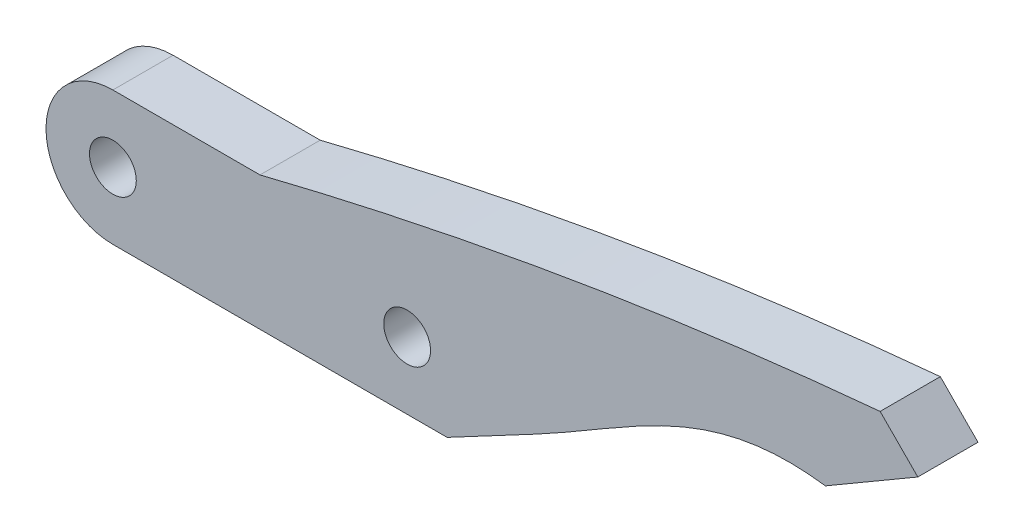
from build123d import *

# Parameters (mm, degrees)
SKETCH1_R           = 5
SKETCH1_R_2         = 1.75
BOSS_EXTRUDE1_DEPTH = 4.5
BOSS_EXTRUDE2_START = -4.5
BOSS_EXTRUDE2_DEPTH = 4.5


with BuildPart() as part:
    # Sketch1 → Boss-Extrude1 (new body)
    # profile 1 of 3: a face of its own
    with BuildSketch(Plane.XY):
        with BuildLine():
            Line((-11.000000031, -5), (11, -5))
            ThreePointArc((11, -5), (6, -6e-09), (10.999999988, 5))
            Line((10.999999988, 5), (-11, 5))
            ThreePointArc((-11, 5), (-7.464466094, 3.535533906), (-6, 0))
            ThreePointArc((-6, 0), (-7.464466105, -3.535533917), (-11.000000031, -5))
        make_face()
    # profile 2 of 3: a face of its own
    with BuildSketch(Plane.XY):
        with Locations((-11, 0)):
            Circle(SKETCH1_R)
        with Locations((-11, 0)):
            Circle(SKETCH1_R_2, mode=Mode.SUBTRACT)
    # profile 3 of 3: a face of its own
    with BuildSketch(Plane.XY):
        with Locations((11, 0)):
            Circle(SKETCH1_R)
        with Locations((11, 0)):
            Circle(SKETCH1_R_2, mode=Mode.SUBTRACT)
    extrude(amount=BOSS_EXTRUDE1_DEPTH)

    # Sketch2 → Boss-Extrude2 (add)
    with BuildSketch(Plane.XY.offset(4.5).offset(BOSS_EXTRUDE2_START)):
        with BuildLine():
            Line((46.363989199, 12.87), (49.180795902, 10.03))
            Line((49.180795902, 10.03), (42.27, 6))
            add(Edge.make_bspline(
                [(42.27, 6), (33.457840426, 7.213673904), (27.801569406, 2.343916059), (20.61, -1.48)],
                knots=[0, 0, 0, 0, 1, 1, 1, 1], degree=3))
            Line((20.61, -1.48), (13.99, -5))
            Line((13.99, -5), (11, -5))
            ThreePointArc((11, -5), (16, 0), (11, 5))
            Line((11, 5), (0, 5))
            add(Edge.make_bspline(
                [(0, 5), (22.885517501, 10.707926651), (46.363989199, 12.87)],
                knots=[0, 0, 0, 1, 1, 1], degree=2))
        make_face()
    extrude(amount=BOSS_EXTRUDE2_DEPTH)


solid = part.part
